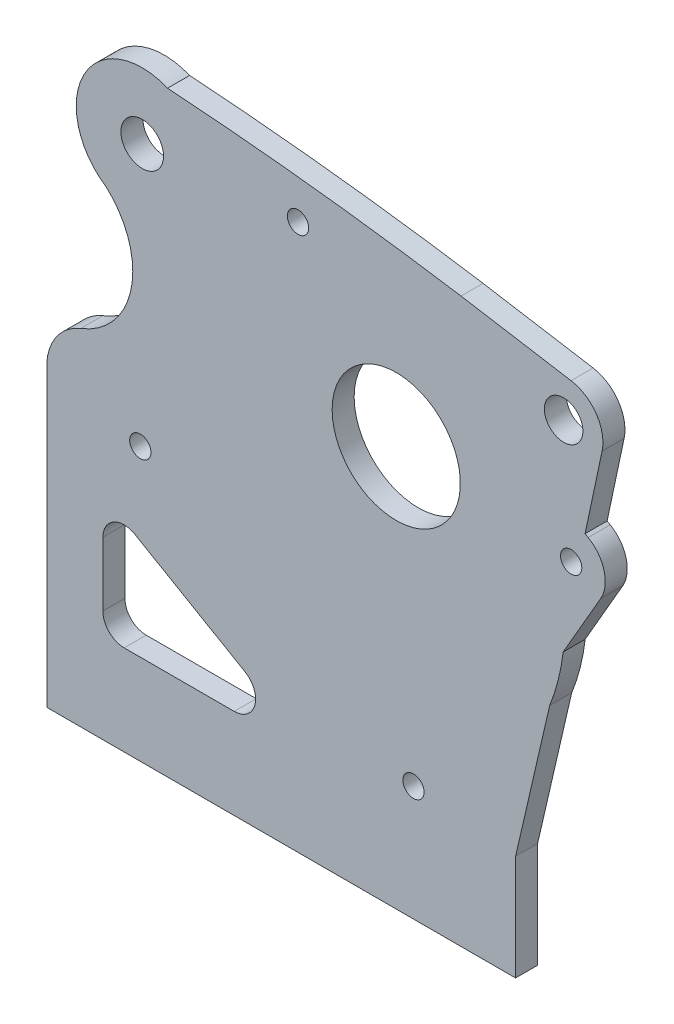
from build123d import *

# Parameters (mm, degrees)
SKETCH1_R           = 5.42927296
SKETCH1_R_2         = 5.999999996
SKETCH1_R_3         = 3
SKETCH1_R_4         = 18.05
BOSS_EXTRUDE1_DEPTH = 6.2


with BuildPart() as part:
    # Sketch1 → Boss-Extrude1 (new body)
    with BuildSketch(Plane.XY):
        with BuildLine():
            Line((39.614582687, 73.90348608), (39.884157083, 73.858752771))
            Line((39.884157083, 73.858752771), (70.59488962, 68.762598575))
            ThreePointArc((70.59488962, 68.762598575), (77.700603566, 64.224178317), (79.330264302, 55.951776308))
            Line((79.330264302, 55.951776308), (74.541718965, 33.423432184))
            Line((74.541718965, 33.423432184), (75.419376917, 32.916716129))
            ThreePointArc((75.419376917, 32.916716129), (79.892264849, 27.087535086), (78.933220793, 19.802872253))
            Line((78.933220793, 19.802872253), (68.367652451, 1.502771074))
            ThreePointArc((68.367652451, 1.502771074), (66.960524587, -6.114993434), (64.564182125, -13.481667564))
            Line((64.564182125, -13.481667564), (54.978164866, -55.003255407))
            Line((54.978164866, -55.003255407), (54.967848993, -84.703266118))
            Line((54.967848993, -84.703266118), (-77.032151007, -84.703266118))
            Line((-77.032151007, -84.703266118), (-77.032151007, -52.303266118))
            Line((-77.032151007, -52.303266118), (-77.032151007, -0.703266118))
            ThreePointArc((-77.032151007, -0.703266118), (-74.12202184, 7.271185396), (-67.432151007, 12.496733882))
            ThreePointArc((-67.432151007, 12.496733882), (-53.19307052, 29.559194605), (-60.354355055, 50.597136112))
            ThreePointArc((-60.354355055, 50.597136112), (-66.563388034, 74.831521387), (-43.015404957, 83.278415086))
            ThreePointArc((-43.015404957, 83.278415086), (-1.595924432, 79.511889283), (39.614582687, 73.90348608))
        make_face()
        with Locations(Location((68.504996686, 58.126398509, 0), (0, 0, 180))):
            Circle(SKETCH1_R, mode=Mode.SUBTRACT)
        with Locations(Location((-50.150905711, 66.123930347, 0), (0, 0, 180))):
            Circle(SKETCH1_R_2, mode=Mode.SUBTRACT)
        with Locations(Location((-6.283678939, 69.002872253, 0), (0, 0, 180))):
            Circle(SKETCH1_R_3, mode=Mode.SUBTRACT)
        with Locations(Location((26.219376917, -52.300183603, 0), (0, 0, 180))):
            Circle(SKETCH1_R_3, mode=Mode.SUBTRACT)
        with Locations(Location((70.619376917, 24.602872253, 0), (0, 0, 180))):
            Circle(SKETCH1_R_3, mode=Mode.SUBTRACT)
        with Locations(Location((-50.683678939, -7.900183603, 0), (0, 0, 180))):
            Circle(SKETCH1_R_3, mode=Mode.SUBTRACT)
        with Locations(Location((21.367848989, 28.096723532, 0), (0, 0, 180))):
            Circle(SKETCH1_R_4, mode=Mode.SUBTRACT)
        with BuildLine():
            ThreePointArc((-24.232151011, -59.303276516), (-18.438516483, -54.863340285), (-21.219337907, -48.114542837))
            Line((-21.219337907, -48.114542837), (-52.219337907, -30.114542837))
            ThreePointArc((-52.219337907, -30.114542837), (-58.225737603, -30.103426585), (-61.232151011, -35.303276516))
            Line((-61.232151011, -35.303276516), (-61.232151011, -53.303276516))
            ThreePointArc((-61.232151011, -53.303276516), (-59.474791698, -57.545917204), (-55.232151011, -59.303276516))
            Line((-55.232151011, -59.303276516), (-24.232151011, -59.303276516))
        make_face(mode=Mode.SUBTRACT)
    extrude(amount=BOSS_EXTRUDE1_DEPTH)


solid = part.part
